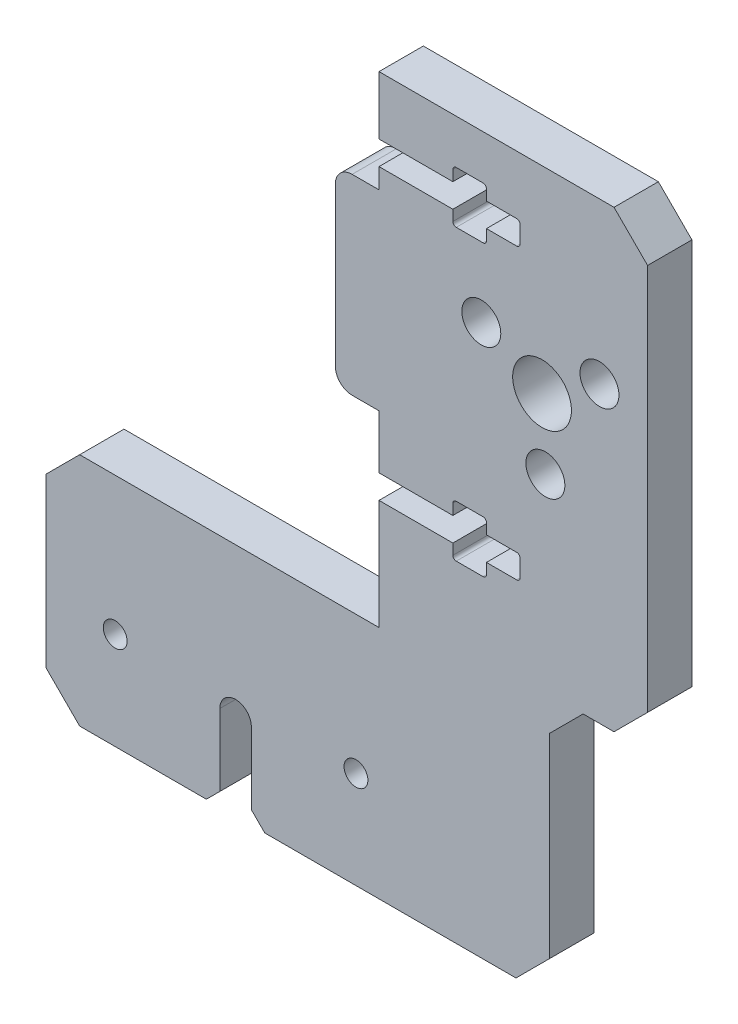
from build123d import *

# Parameters (mm, degrees)
MODEL_R             = 4.375
MODEL_R_2           = 2.9
MODEL_R_3           = 1.775
BOSS_EXTRUDE1_DEPTH = 6.6


with BuildPart() as part:
    # Model → Boss-Extrude1 (new body)
    with BuildSketch(Plane.XY):
        with BuildLine():
            Line((-24.79, -12.5), (-19.79, -17.5))
            Line((-19.79, -17.5), (-0.9195, -17.5))
            Line((-0.9195, -17.5), (1.0805, -15.5))
            Line((1.0805, -15.5), (1.0805, -4.8))
            ThreePointArc((1.0805, -4.8), (3.43, -2.4505), (5.7795, -4.8))
            Line((5.7795, -4.8), (5.7795, -15.5))
            Line((5.7795, -15.5), (7.7795, -17.5))
            Line((7.7795, -17.5), (45.19, -17.5))
            Line((45.19, -17.5), (50.19, -12.5))
            Line((50.19, -12.5), (50.19, 16.555))
            Line((50.19, 16.555), (55.19, 21.555))
            Line((55.19, 21.555), (59.79, 21.555))
            Line((59.79, 21.555), (64.79, 26.555))
            Line((64.79, 26.555), (64.79, 84.19991216))
            Line((64.79, 84.19991216), (59.79, 89.19991216))
            Line((59.79, 89.19991216), (24.79, 89.19991216))
            Line((24.79, 89.19991216), (24.79, 80.500006241))
            Line((24.79, 80.500006241), (35.79, 80.500006241))
            Line((35.79, 80.500006241), (35.79, 82.085006241))
            ThreePointArc((35.79, 82.085006241), (35.936446609, 82.438559632), (36.29, 82.585006241))
            Line((36.29, 82.585006241), (40.29, 82.585006241))
            ThreePointArc((40.29, 82.585006241), (40.643553391, 82.438559632), (40.79, 82.085006241))
            Line((40.79, 82.085006241), (40.79, 80.500006241))
            Line((40.79, 80.500006241), (45.29, 80.500006241))
            ThreePointArc((45.29, 80.500006241), (45.643553391, 80.353559632), (45.79, 80.000006241))
            Line((45.79, 80.000006241), (45.79, 77.450006241))
            ThreePointArc((45.79, 77.450006241), (45.643553391, 77.09645285), (45.29, 76.950006241))
            Line((45.29, 76.950006241), (40.79, 76.950006241))
            Line((40.79, 76.950006241), (40.79, 75.365006241))
            ThreePointArc((40.79, 75.365006241), (40.643553391, 75.01145285), (40.29, 74.865006241))
            Line((40.29, 74.865006241), (36.29, 74.865006241))
            ThreePointArc((36.29, 74.865006241), (35.936446609, 75.01145285), (35.79, 75.365006241))
            Line((35.79, 75.365006241), (35.79, 76.950006241))
            Line((35.79, 76.950006241), (24.79, 76.950006241))
            Line((24.79, 76.950006241), (24.79, 73.950006241))
            Line((24.79, 73.950006241), (20.79, 73.950006241))
            ThreePointArc((20.79, 73.950006241), (19.022233047, 73.217773194), (18.29, 71.450006241))
            Line((18.29, 71.450006241), (18.29, 47.950006241))
            ThreePointArc((18.29, 47.950006241), (19.022233047, 46.182239288), (20.79, 45.450006241))
            Line((20.79, 45.450006241), (24.79, 45.450006241))
            Line((24.79, 45.450006241), (24.79, 37.450006241))
            Line((24.79, 37.450006241), (35.79, 37.450006241))
            Line((35.79, 37.450006241), (35.79, 39.035006241))
            ThreePointArc((35.79, 39.035006241), (35.936446609, 39.388559632), (36.29, 39.535006241))
            Line((36.29, 39.535006241), (40.29, 39.535006241))
            ThreePointArc((40.29, 39.535006241), (40.643553391, 39.388559632), (40.79, 39.035006241))
            Line((40.79, 39.035006241), (40.79, 37.450006241))
            Line((40.79, 37.450006241), (45.29, 37.450006241))
            ThreePointArc((45.29, 37.450006241), (45.643553391, 37.303559632), (45.79, 36.950006241))
            Line((45.79, 36.950006241), (45.79, 34.400006241))
            ThreePointArc((45.79, 34.400006241), (45.643553391, 34.04645285), (45.29, 33.900006241))
            Line((45.29, 33.900006241), (40.79, 33.900006241))
            Line((40.79, 33.900006241), (40.79, 32.315006241))
            ThreePointArc((40.79, 32.315006241), (40.643553391, 31.96145285), (40.29, 31.815006241))
            Line((40.29, 31.815006241), (36.29, 31.815006241))
            ThreePointArc((36.29, 31.815006241), (35.936446609, 31.96145285), (35.79, 32.315006241))
            Line((35.79, 32.315006241), (35.79, 33.900006241))
            Line((35.79, 33.900006241), (24.79, 33.900006241))
            Line((24.79, 33.900006241), (24.79, 17.5))
            Line((24.79, 17.5), (-19.79, 17.5))
            Line((-19.79, 17.5), (-24.79, 12.5))
            Line((-24.79, 12.5), (-24.79, -12.5))
        make_face()
        with Locations((49.071999999, 59.812938251)):
            Circle(MODEL_R, mode=Mode.SUBTRACT)
        with Locations((57.621173682, 65.321162043)):
            Circle(MODEL_R_2, mode=Mode.SUBTRACT)
        with Locations((40.027151425, 64.462627946)):
            Circle(MODEL_R_2, mode=Mode.SUBTRACT)
        with Locations((49.567674891, 49.655024765)):
            Circle(MODEL_R_2, mode=Mode.SUBTRACT)
        with Locations((-14.5, -3.025)):
            Circle(MODEL_R_3, mode=Mode.SUBTRACT)
        with Locations((21.36, -3.025)):
            Circle(MODEL_R_3, mode=Mode.SUBTRACT)
    extrude(amount=BOSS_EXTRUDE1_DEPTH)


solid = part.part
